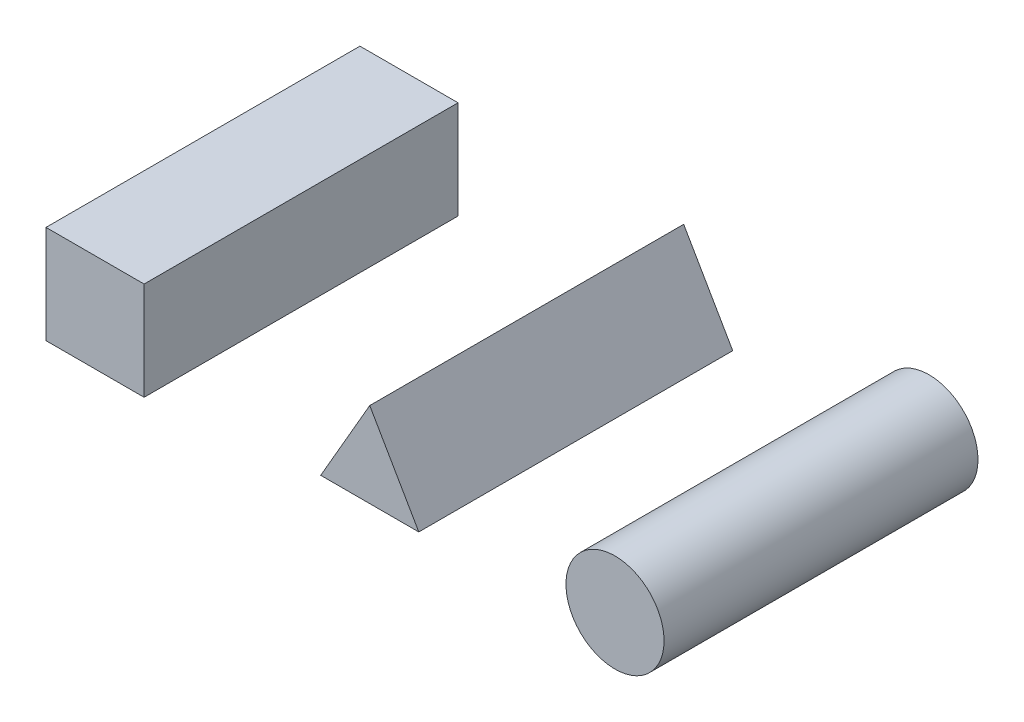
from build123d import *

# Parameters (mm, degrees)
SKETCH1_R             = 12.5
BOSS_EXTRUDE1_DEPTH   = 80
BOSS_EXTRUDE1_2_DEPTH = 80
SKETCH1_W             = 25
SKETCH1_H             = 25
BOSS_EXTRUDE1_3_DEPTH = 80


with BuildPart() as part:
    # Sketch1 → Boss-Extrude1 (new body)
    with BuildSketch(Plane.XY):
        with Locations((62.5, 0)):
            Circle(SKETCH1_R)
    extrude(amount=BOSS_EXTRUDE1_DEPTH)


with BuildPart() as body_2:
    # Sketch1 → Boss-Extrude1 2 (new body)
    with BuildSketch(Plane.XY):
        Polygon((-12.5, -7.216878365), (0, 14.43375673), (12.5, -7.216878365), align=None)
    extrude(amount=BOSS_EXTRUDE1_2_DEPTH)


with BuildPart() as body_3:
    # Sketch1 → Boss-Extrude1 3 (new body)
    with BuildSketch(Plane.XY):
        with Locations((-70, 0)):
            Rectangle(SKETCH1_W, SKETCH1_H)
    extrude(amount=BOSS_EXTRUDE1_3_DEPTH)


solid = Compound([part.part, body_2.part, body_3.part])
